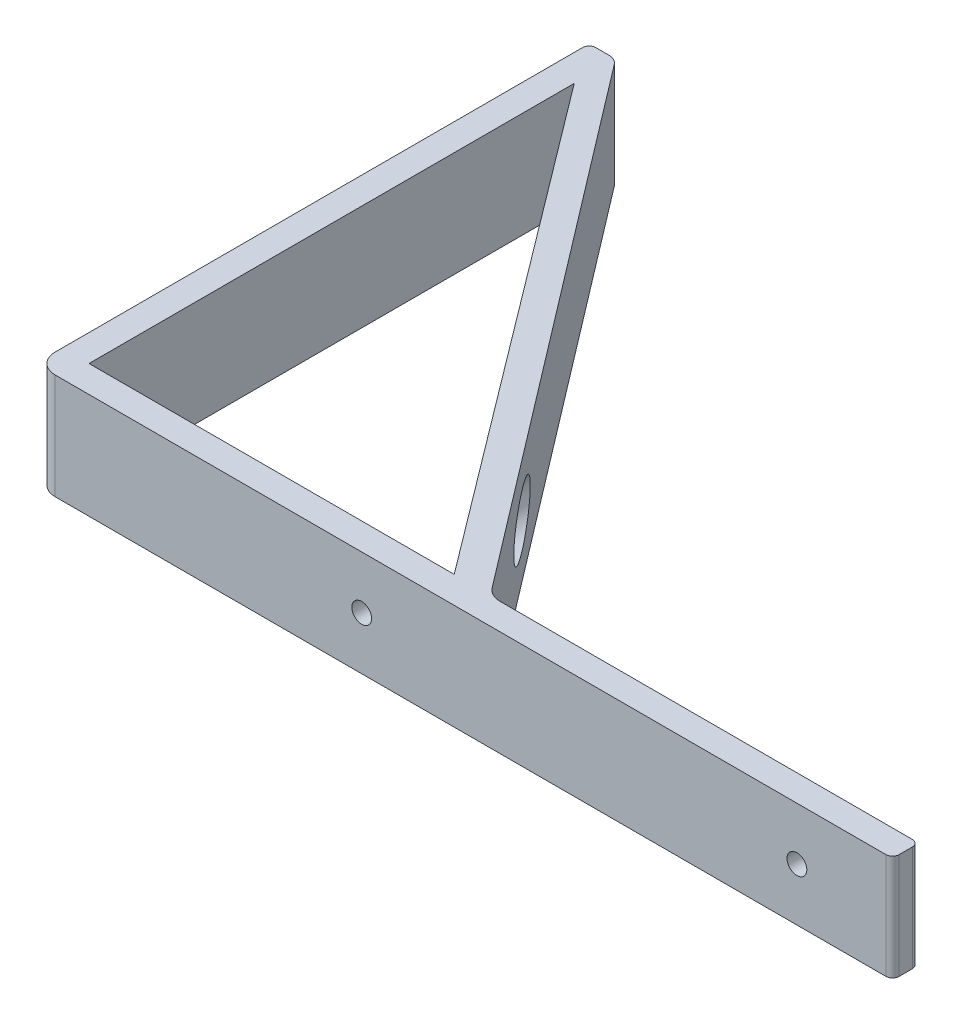
from build123d import *

# Parameters (mm, degrees)
BOSS_EXTRUDE4_DEPTH = 16
CUT_EXTRUDE1_DEPTH  = 16
SKETCH4_R           = 1.5
CUT_EXTRUDE3_DEPTH  = 16
SKETCH6_R           = 4
CUT_EXTRUDE4_DEPTH  = 134.582030626


with BuildPart() as part:
    # Sketch1 → Boss-Extrude4 (new body)
    with BuildSketch(Plane(origin=(0, 0, 0), x_dir=(1, 0, 0), z_dir=(0, 1, 0))):
        with BuildLine():
            Line((-101.232266869, 84.812685314), (-41.738030485, 6.78745727))
            ThreePointArc((-41.738030485, 6.78745727), (-40.683381354, 5.917890449), (-39.352420031, 5.606485241))
            Line((-39.352420031, 5.606485241), (23.167405683, 5.606485241))
            ThreePointArc((23.167405683, 5.606485241), (23.874512464, 5.313592022), (24.167405683, 4.606485241))
            Line((24.167405683, 4.606485241), (24.167405683, 2.606485241))
            ThreePointArc((24.167405683, 2.606485241), (23.874512464, 1.89937846), (23.167405683, 1.606485241))
            Line((23.167405683, 1.606485241), (-102.832594317, 1.606485241))
            ThreePointArc((-102.832594317, 1.606485241), (-104.95391466, 2.485164898), (-105.832594317, 4.606485241))
            Line((-105.832594317, 4.606485241), (-105.832594317, 5.6))
            Line((-105.832594317, 5.6), (-105.832594317, 84.6))
            ThreePointArc((-105.832594317, 84.6), (-105.539701098, 85.307106781), (-104.832594317, 85.6))
            Line((-104.832594317, 85.6), (-102.822673838, 85.6))
            ThreePointArc((-102.822673838, 85.6), (-101.93536629, 85.392396528), (-101.232266869, 84.812685314))
        make_face()
    extrude(amount=BOSS_EXTRUDE4_DEPTH)

    # Sketch2 → Cut-Extrude1 (cut)
    with BuildSketch(Plane(origin=(0, 16, 0), x_dir=(1, 0, 0), z_dir=(0, 1, 0))):
        Polygon((-101.761672648, 5.67740691), (-46.376523222, 5.67740691), (-101.761672648, 79.266350208), align=None)
    extrude(amount=-CUT_EXTRUDE1_DEPTH, mode=Mode.SUBTRACT)

    # Sketch4 → Cut-Extrude3 (cut)
    with BuildSketch(Plane.XY.offset(-1.606485241)):
        with Locations((9.667405683, 8)):
            Circle(SKETCH4_R)
        with Locations((-56.332594317, 8)):
            Circle(SKETCH4_R)
    extrude(amount=-CUT_EXTRUDE3_DEPTH, mode=Mode.SUBTRACT)

    # Sketch6 → Cut-Extrude4 (cut, through all)
    with BuildSketch(Plane(origin=(0, 0, -5.67740691), x_dir=(-1, 0, 0), z_dir=(0, 0, -1))):
        with Locations(Location((56.297582792, 8, 0), (0, 0, 180))):
            Circle(SKETCH6_R)
    extrude(amount=CUT_EXTRUDE4_DEPTH, mode=Mode.SUBTRACT)


solid = part.part
